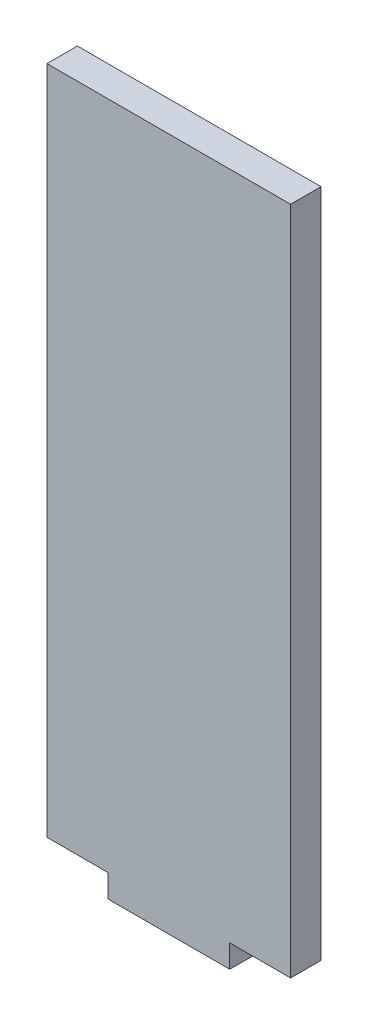
from build123d import *

# Parameters (mm, degrees)
BOSS_EXTRUDE1_DEPTH = 3.175


with BuildPart() as part:
    # Sketch1 → Boss-Extrude1 (new body)
    with BuildSketch(Plane.XY):
        Polygon((6.35, 0), (6.35, -2.387934918), (19.05, -2.387934918), (19.05, 0), (25.4, 0), (25.4, 69.85), (0, 69.85), (0, 0), align=None)
    extrude(amount=BOSS_EXTRUDE1_DEPTH)


solid = part.part
